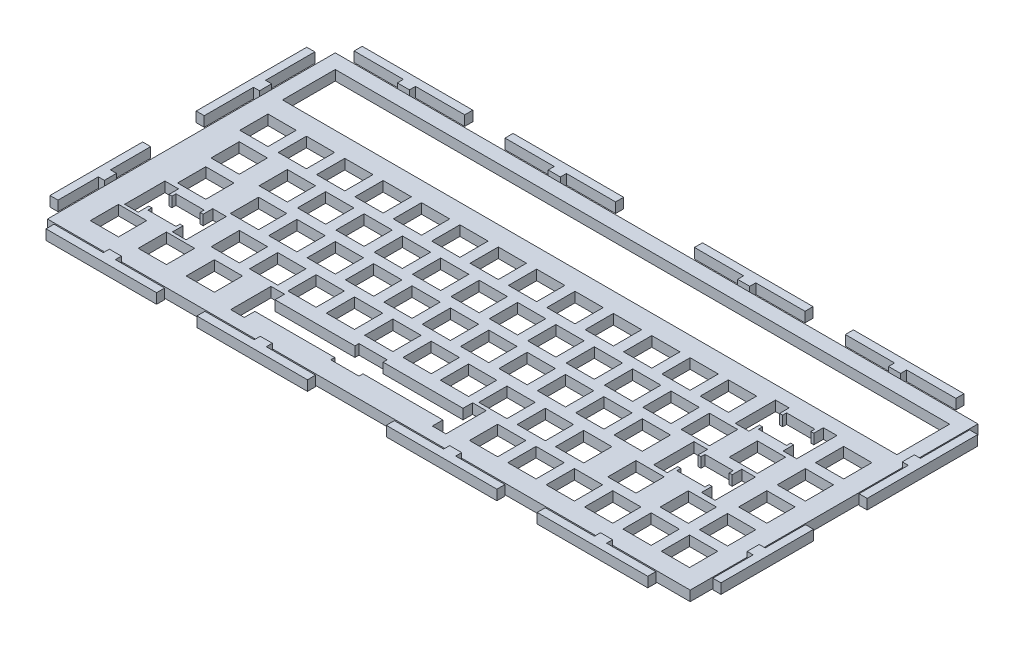
from build123d import *

# Parameters (mm, degrees)
SKETCH1_W           = 319.08
SKETCH1_H           = 142.875
SKETCH1_W_2         = 14
SKETCH1_H_2         = 14
SKETCH1_W_3         = 305
SKETCH1_H_3         = 26.2
BOSS_EXTRUDE2_DEPTH = 2.5
BOSS_EXTRUDE3_DEPTH = 2.5


with BuildPart() as part:
    # Sketch1 → Boss-Extrude2 (new, symmetric)
    with BuildSketch(Plane(origin=(0, 0, 0), x_dir=(1, 0, 0), z_dir=(0, 1, 0))):
        with Locations((55.118496059, 23.552072889)):
            Rectangle(SKETCH1_W, SKETCH1_H)
        with Locations((-68.754503941, 44.995572889)):
            Rectangle(SKETCH1_W_2, SKETCH1_H_2, mode=Mode.SUBTRACT)
        with Locations((-87.826503941, 44.995572889)):
            Rectangle(SKETCH1_W_2, SKETCH1_H_2, mode=Mode.SUBTRACT)
        with Locations((140.749496059, 44.995572889)):
            Rectangle(SKETCH1_W_2, SKETCH1_H_2, mode=Mode.SUBTRACT)
        with Locations((-30.654503941, 44.995572889)):
            Rectangle(SKETCH1_W_2, SKETCH1_H_2, mode=Mode.SUBTRACT)
        with Locations((-49.704503941, 44.995572889)):
            Rectangle(SKETCH1_W_2, SKETCH1_H_2, mode=Mode.SUBTRACT)
        with Locations((7.445496059, 44.995572889)):
            Rectangle(SKETCH1_W_2, SKETCH1_H_2, mode=Mode.SUBTRACT)
        with Locations((-11.604503941, 44.995572889)):
            Rectangle(SKETCH1_W_2, SKETCH1_H_2, mode=Mode.SUBTRACT)
        with Locations((45.545496059, 44.995572889)):
            Rectangle(SKETCH1_W_2, SKETCH1_H_2, mode=Mode.SUBTRACT)
        with Locations((26.495496059, 44.995572889)):
            Rectangle(SKETCH1_W_2, SKETCH1_H_2, mode=Mode.SUBTRACT)
        with Locations((174.183496059, 25.945572889)):
            Rectangle(SKETCH1_W_2, SKETCH1_H_2, mode=Mode.SUBTRACT)
        with Locations((83.645496059, 44.995572889)):
            Rectangle(SKETCH1_W_2, SKETCH1_H_2, mode=Mode.SUBTRACT)
        with Locations((64.595496059, 44.995572889)):
            Rectangle(SKETCH1_W_2, SKETCH1_H_2, mode=Mode.SUBTRACT)
        with Locations((121.722496059, 44.995572889)):
            Rectangle(SKETCH1_W_2, SKETCH1_H_2, mode=Mode.SUBTRACT)
        with Locations((102.695496059, 44.995572889)):
            Rectangle(SKETCH1_W_2, SKETCH1_H_2, mode=Mode.SUBTRACT)
        Polygon((162.399496059, 52.245572889), (176.399496059, 52.245572889), (176.399496059, 50.245572889), (177.899496059, 50.245572889), (177.899496059, 54.995572889), (184.649496059, 54.995572889), (184.649496059, 34.995572889), (177.899496059, 34.995572889), (177.899496059, 40.245572889), (176.399496059, 40.245572889), (176.399496059, 38.245572889), (162.399496059, 38.245572889), (162.399496059, 40.245572889), (160.899496059, 40.245572889), (160.899496059, 34.995572889), (154.149496059, 34.995572889), (154.149496059, 54.995572889), (160.899496059, 54.995572889), (160.899496059, 50.245572889), (162.399496059, 50.245572889), align=None, mode=Mode.SUBTRACT)
        with Locations((-40.126503941, 25.945572889)):
            Rectangle(SKETCH1_W_2, SKETCH1_H_2, mode=Mode.SUBTRACT)
        with Locations((-59.176503941, 25.945572889)):
            Rectangle(SKETCH1_W_2, SKETCH1_H_2, mode=Mode.SUBTRACT)
        with Locations((-2.051503941, 25.945572889)):
            Rectangle(SKETCH1_W_2, SKETCH1_H_2, mode=Mode.SUBTRACT)
        with Locations((-21.076503941, 25.945572889)):
            Rectangle(SKETCH1_W_2, SKETCH1_H_2, mode=Mode.SUBTRACT)
        with Locations((36.073496059, 25.945572889)):
            Rectangle(SKETCH1_W_2, SKETCH1_H_2, mode=Mode.SUBTRACT)
        with Locations((16.948496059, 25.945572889)):
            Rectangle(SKETCH1_W_2, SKETCH1_H_2, mode=Mode.SUBTRACT)
        with Locations((74.148496059, 25.945572889)):
            Rectangle(SKETCH1_W_2, SKETCH1_H_2, mode=Mode.SUBTRACT)
        with Locations((55.123496059, 25.945572889)):
            Rectangle(SKETCH1_W_2, SKETCH1_H_2, mode=Mode.SUBTRACT)
        Polygon((159.986496059, 14.145572889), (173.986496059, 14.145572889), (173.986496059, 12.145572889), (175.486496059, 12.145572889), (175.486496059, 16.895572889), (182.236496059, 16.895572889), (182.236496059, -3.104427111), (175.486496059, -3.104427111), (175.486496059, 2.145572889), (173.986496059, 2.145572889), (173.986496059, 0.145572889), (159.986496059, 0.145572889), (159.986496059, 2.145572889), (158.486496059, 2.145572889), (158.486496059, -3.104427111), (151.736496059, -3.104427111), (151.736496059, 16.895572889), (158.486496059, 16.895572889), (158.486496059, 12.145572889), (159.986496059, 12.145572889), align=None, mode=Mode.SUBTRACT)
        with Locations((-35.363503941, 6.895572889)):
            Rectangle(SKETCH1_W_2, SKETCH1_H_2, mode=Mode.SUBTRACT)
        with Locations((-54.413503941, 6.895572889)):
            Rectangle(SKETCH1_W_2, SKETCH1_H_2, mode=Mode.SUBTRACT)
        with Locations((112.273496059, 25.945572889)):
            Rectangle(SKETCH1_W_2, SKETCH1_H_2, mode=Mode.SUBTRACT)
        with Locations((93.223496059, 25.945572889)):
            Rectangle(SKETCH1_W_2, SKETCH1_H_2, mode=Mode.SUBTRACT)
        with Locations((-83.063503941, 25.945572889)):
            Rectangle(SKETCH1_W_2, SKETCH1_H_2, mode=Mode.SUBTRACT)
        with Locations((131.323496059, 25.945572889)):
            Rectangle(SKETCH1_W_2, SKETCH1_H_2, mode=Mode.SUBTRACT)
        with Locations((150.373496059, 25.945572889)):
            Rectangle(SKETCH1_W_2, SKETCH1_H_2, mode=Mode.SUBTRACT)
        with Locations((2.736496059, 6.895572889)):
            Rectangle(SKETCH1_W_2, SKETCH1_H_2, mode=Mode.SUBTRACT)
        with Locations((-16.313503941, 6.895572889)):
            Rectangle(SKETCH1_W_2, SKETCH1_H_2, mode=Mode.SUBTRACT)
        with Locations((40.836496059, 6.895572889)):
            Rectangle(SKETCH1_W_2, SKETCH1_H_2, mode=Mode.SUBTRACT)
        with Locations((21.786496059, 6.895572889)):
            Rectangle(SKETCH1_W_2, SKETCH1_H_2, mode=Mode.SUBTRACT)
        with Locations((78.936496059, 6.895572889)):
            Rectangle(SKETCH1_W_2, SKETCH1_H_2, mode=Mode.SUBTRACT)
        with Locations((59.886496059, 6.895572889)):
            Rectangle(SKETCH1_W_2, SKETCH1_H_2, mode=Mode.SUBTRACT)
        with Locations((117.036496059, 6.895572889)):
            Rectangle(SKETCH1_W_2, SKETCH1_H_2, mode=Mode.SUBTRACT)
        with Locations((97.986496059, 6.895572889)):
            Rectangle(SKETCH1_W_2, SKETCH1_H_2, mode=Mode.SUBTRACT)
        with Locations((-80.607503941, 6.895572889)):
            Rectangle(SKETCH1_W_2, SKETCH1_H_2, mode=Mode.SUBTRACT)
        with Locations((136.086496059, 6.895572889)):
            Rectangle(SKETCH1_W_2, SKETCH1_H_2, mode=Mode.SUBTRACT)
        with Locations((-25.838503941, -12.154427111)):
            Rectangle(SKETCH1_W_2, SKETCH1_H_2, mode=Mode.SUBTRACT)
        with Locations((-44.888503941, -12.154427111)):
            Rectangle(SKETCH1_W_2, SKETCH1_H_2, mode=Mode.SUBTRACT)
        with Locations((12.261496059, -12.154427111)):
            Rectangle(SKETCH1_W_2, SKETCH1_H_2, mode=Mode.SUBTRACT)
        with Locations((-6.788503941, -12.154427111)):
            Rectangle(SKETCH1_W_2, SKETCH1_H_2, mode=Mode.SUBTRACT)
        with Locations((50.361496059, -12.154427111)):
            Rectangle(SKETCH1_W_2, SKETCH1_H_2, mode=Mode.SUBTRACT)
        with Locations((31.311496059, -12.154427111)):
            Rectangle(SKETCH1_W_2, SKETCH1_H_2, mode=Mode.SUBTRACT)
        with Locations((88.461496059, -12.654427111)):
            Rectangle(SKETCH1_W_2, SKETCH1_H_2, mode=Mode.SUBTRACT)
        with Locations((69.411496059, -12.654427111)):
            Rectangle(SKETCH1_W_2, SKETCH1_H_2, mode=Mode.SUBTRACT)
        with Locations((126.561496059, -12.654427111)):
            Rectangle(SKETCH1_W_2, SKETCH1_H_2, mode=Mode.SUBTRACT)
        with Locations((107.511496059, -12.654427111)):
            Rectangle(SKETCH1_W_2, SKETCH1_H_2, mode=Mode.SUBTRACT)
        Polygon((-83.344503941, -5.154427111), (-69.344503941, -5.154427111), (-69.344503941, -7.154427111), (-67.844503941, -7.154427111), (-67.844503941, -2.404427111), (-61.094503941, -2.404427111), (-61.094503941, -22.404427111), (-67.844503941, -22.404427111), (-67.844503941, -17.154427111), (-69.344503941, -17.154427111), (-69.344503941, -19.154427111), (-83.344503941, -19.154427111), (-83.344503941, -17.154427111), (-84.844503941, -17.154427111), (-84.844503941, -22.404427111), (-91.594503941, -22.404427111), (-91.594503941, -2.404427111), (-84.844503941, -2.404427111), (-84.844503941, -7.154427111), (-83.344503941, -7.154427111), align=None, mode=Mode.SUBTRACT)
        with Locations((152.523496059, -12.654427111)):
            Rectangle(SKETCH1_W_2, SKETCH1_H_2, mode=Mode.SUBTRACT)
        with Locations((178.485496059, -12.654427111)):
            Rectangle(SKETCH1_W_2, SKETCH1_H_2, mode=Mode.SUBTRACT)
        with Locations((55.223496059, 74.745572889)):
            Rectangle(SKETCH1_W_3, SKETCH1_H_3, mode=Mode.SUBTRACT)
        with Locations((197.995496059, 25.945572889)):
            Rectangle(SKETCH1_W_2, SKETCH1_H_2, mode=Mode.SUBTRACT)
        with Locations((197.974496059, 44.995572889)):
            Rectangle(SKETCH1_W_2, SKETCH1_H_2, mode=Mode.SUBTRACT)
        with Locations((197.942496059, 6.895572889)):
            Rectangle(SKETCH1_W_2, SKETCH1_H_2, mode=Mode.SUBTRACT)
        with Locations((197.985496059, -12.654427111)):
            Rectangle(SKETCH1_W_2, SKETCH1_H_2, mode=Mode.SUBTRACT)
        with Locations((-86.094503941, -30.954427111)):
            Rectangle(SKETCH1_W_2, SKETCH1_H_2, mode=Mode.SUBTRACT)
        with Locations((-62.294503941, -30.954427111)):
            Rectangle(SKETCH1_W_2, SKETCH1_H_2, mode=Mode.SUBTRACT)
        with Locations((-38.494503941, -30.954427111)):
            Rectangle(SKETCH1_W_2, SKETCH1_H_2, mode=Mode.SUBTRACT)
        Polygon((26.439496059, -24.114427111), (40.439496059, -24.114427111), (40.439496059, -26.114427111), (80.123496059, -26.114427111), (80.123496059, -21.364427111), (86.873496059, -21.364427111), (86.873496059, -41.364427111), (80.123496059, -41.364427111), (80.123496059, -36.114427111), (40.439496059, -36.114427111), (40.439496059, -38.114427111), (26.439496059, -38.114427111), (26.439496059, -36.114427111), (-13.244503941, -36.114427111), (-13.244503941, -41.364427111), (-19.994503941, -41.364427111), (-19.994503941, -21.364427111), (-13.244503941, -21.364427111), (-13.244503941, -26.114427111), (26.439496059, -26.114427111), align=None, mode=Mode.SUBTRACT)
        with Locations((102.543496059, -31.364427111)):
            Rectangle(SKETCH1_W_2, SKETCH1_H_2, mode=Mode.SUBTRACT)
        with Locations((121.593496059, -31.364427111)):
            Rectangle(SKETCH1_W_2, SKETCH1_H_2, mode=Mode.SUBTRACT)
        with Locations((140.643496059, -31.364427111)):
            Rectangle(SKETCH1_W_2, SKETCH1_H_2, mode=Mode.SUBTRACT)
        with Locations((159.693496059, -31.364427111)):
            Rectangle(SKETCH1_W_2, SKETCH1_H_2, mode=Mode.SUBTRACT)
        with Locations((178.743496059, -31.364427111)):
            Rectangle(SKETCH1_W_2, SKETCH1_H_2, mode=Mode.SUBTRACT)
        with Locations((197.793496059, -31.364427111)):
            Rectangle(SKETCH1_W_2, SKETCH1_H_2, mode=Mode.SUBTRACT)
    extrude(amount=BOSS_EXTRUDE2_DEPTH, both=True)

    # Sketch2 → Boss-Extrude3 (add, symmetric)
    with BuildSketch(Plane(origin=(0, 2.5, 0), x_dir=(1, 0, 0), z_dir=(0, 1, 0))):
        Polygon((-104.421503941, 63.389572889), (-104.421503941, 57.389572889), (-107.421503941, 57.389572889), (-107.421503941, 32.945572889), (-111.421503941, 32.945572889), (-111.421503941, 87.845572889), (-107.421503941, 87.845572889), (-107.421503941, 63.389572889), align=None)
        Polygon((-104.421503941, -13.635427111), (-104.421503941, -19.635427111), (-107.421503941, -19.635427111), (-107.421503941, -39.635427111), (-111.421503941, -39.635427111), (-111.421503941, 6.364572889), (-107.421503941, 6.364572889), (-107.421503941, -13.635427111), align=None)
        Polygon((221.658496059, -39.635427111), (217.658496059, -39.635427111), (217.658496059, -19.635427111), (214.658496059, -19.635427111), (214.658496059, -13.635427111), (217.658496059, -13.635427111), (217.658496059, 6.364572889), (221.658496059, 6.364572889), align=None)
        Polygon((214.658496059, 63.389572889), (217.658496059, 63.389572889), (217.658496059, 87.845572889), (221.658496059, 87.845572889), (221.658496059, 32.945572889), (217.658496059, 32.945572889), (217.658496059, 57.389572889), (214.658496059, 57.389572889), align=None)
        Polygon((170.233496059, 94.989572889), (176.233496059, 94.989572889), (176.233496059, 97.989572889), (200.683496059, 97.989572889), (200.683496059, 101.989572889), (145.783496059, 101.989572889), (145.783496059, 97.989572889), (170.233496059, 97.989572889), align=None)
        Polygon((95.333496059, 94.989572889), (101.333496059, 94.989572889), (101.333496059, 97.989572889), (125.783496059, 97.989572889), (125.783496059, 101.989572889), (70.883496059, 101.989572889), (70.883496059, 97.989572889), (95.333496059, 97.989572889), align=None)
        Polygon((-43.151503941, 97.989572889), (-67.601503941, 97.989572889), (-67.601503941, 94.989572889), (-73.601503941, 94.989572889), (-73.601503941, 97.989572889), (-98.051503941, 97.989572889), (-98.051503941, 101.989572889), (-43.151503941, 101.989572889), align=None)
        Polygon((7.298496059, 97.989572889), (7.298496059, 94.989572889), (1.298496059, 94.989572889), (1.298496059, 97.989572889), (-23.151503941, 97.989572889), (-23.151503941, 101.989572889), (31.748496059, 101.989572889), (31.748496059, 97.989572889), align=None)
        Polygon((145.783496059, -50.982736199), (170.233496059, -50.982736199), (170.233496059, -47.982736199), (176.233496059, -47.982736199), (176.233496059, -50.982736199), (200.683496059, -50.982736199), (200.683496059, -54.982736199), (145.783496059, -54.982736199), align=None)
        Polygon((95.333496059, -50.982736199), (95.333496059, -47.982736199), (101.333496059, -47.982736199), (101.333496059, -50.982736199), (125.783496059, -50.982736199), (125.783496059, -54.982736199), (70.883496059, -54.982736199), (70.883496059, -50.982736199), align=None)
        Polygon((31.748496059, -50.982736199), (7.298496059, -50.982736199), (7.298496059, -47.982736199), (1.298496059, -47.982736199), (1.298496059, -50.982736199), (-23.151503941, -50.982736199), (-23.151503941, -54.982736199), (31.748496059, -54.982736199), align=None)
        Polygon((-43.151503941, -54.982736199), (-43.151503941, -50.982736199), (-67.601503941, -50.982736199), (-67.601503941, -47.982736199), (-73.601503941, -47.982736199), (-73.601503941, -50.982736199), (-98.051503941, -50.982736199), (-98.051503941, -54.982736199), align=None)
    extrude(amount=BOSS_EXTRUDE3_DEPTH, both=True)


with BuildPart() as boss_extrude3_piece_1:
    # of the separate pieces the step leaves, piece 1, a body of its own (boss_extrude3_pieces)
    add(part.part.solids().sort_by_distance((-104.421503941, -2.5, -94.989572889))[0])


with BuildPart() as boss_extrude3_piece_2:
    # of the separate pieces the step leaves, piece 2, a body of its own (boss_extrude3_pieces)
    add(part.part.solids().sort_by_distance((-43.151503941, 0, 54.982736199))[0])


with BuildPart() as boss_extrude3_piece_3:
    # of the separate pieces the step leaves, piece 3, a body of its own (boss_extrude3_pieces)
    add(part.part.solids().sort_by_distance((145.783496059, 0, 50.982736199))[0])


with BuildPart() as boss_extrude3_piece_4:
    # of the separate pieces the step leaves, piece 4, a body of its own (boss_extrude3_pieces)
    add(part.part.solids().sort_by_distance((95.333496059, 0, 50.982736199))[0])


with BuildPart() as boss_extrude3_piece_5:
    # of the separate pieces the step leaves, piece 5, a body of its own (boss_extrude3_pieces)
    add(part.part.solids().sort_by_distance((31.748496059, 0, 50.982736199))[0])


solid = Compound([boss_extrude3_piece_1.part, boss_extrude3_piece_2.part, boss_extrude3_piece_3.part, boss_extrude3_piece_4.part, boss_extrude3_piece_5.part])
